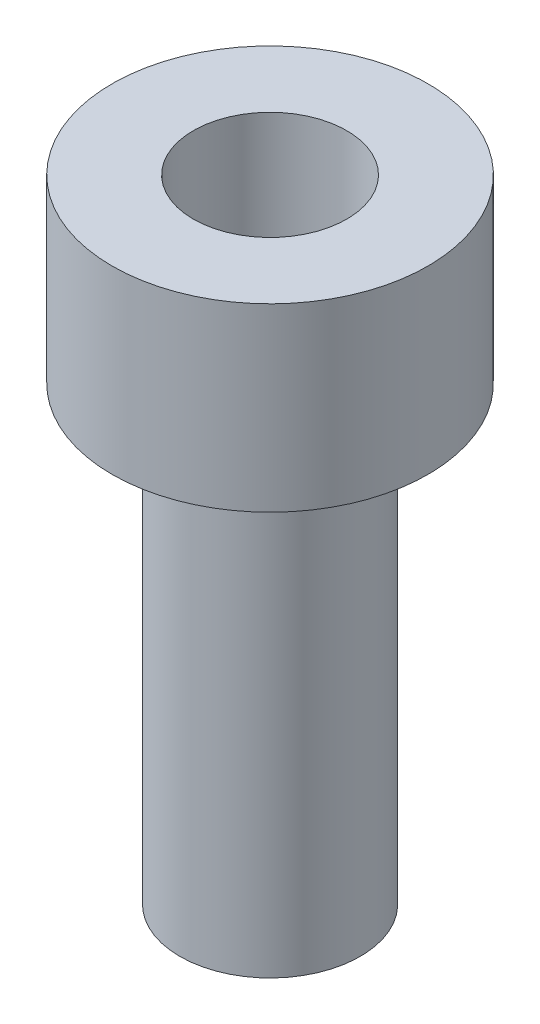
from build123d import *

# Parameters (mm, degrees)
SKETCH1_R    = 3.5
HEAD_DEPTH   = 4
SHANK_START  = -10
SKETCH2_R    = 2
SHANK_DEPTH  = 10
SOCKET_START = 4
SKETCH3_R    = 1.7
SOCKET_DEPTH = 2.4


with BuildPart() as part:
    # Sketch1 → Head (new body)
    with BuildSketch(Plane(origin=(0, 0, 0), x_dir=(1, 0, 0), z_dir=(0, 1, 0))):
        with Locations(Location((0, 0, 0), (0, 0, 270))):
            Circle(SKETCH1_R)
    extrude(amount=HEAD_DEPTH)

    # Sketch2 → Shank (add)
    with BuildSketch(Plane(origin=(0, 0, 0), x_dir=(1, 0, 0), z_dir=(0, 1, 0)).offset(SHANK_START)):
        with Locations(Location((0, 0, 0), (0, 0, 270))):
            Circle(SKETCH2_R)
    extrude(amount=SHANK_DEPTH)

    # Sketch3 → Socket (cut)
    with BuildSketch(Plane(origin=(0, 0, 0), x_dir=(1, 0, 0), z_dir=(0, 1, 0)).offset(SOCKET_START)):
        with Locations(Location((0, 0, 0), (0, 0, 270))):
            Circle(SKETCH3_R)
    extrude(amount=-SOCKET_DEPTH, mode=Mode.SUBTRACT)


solid = part.part
